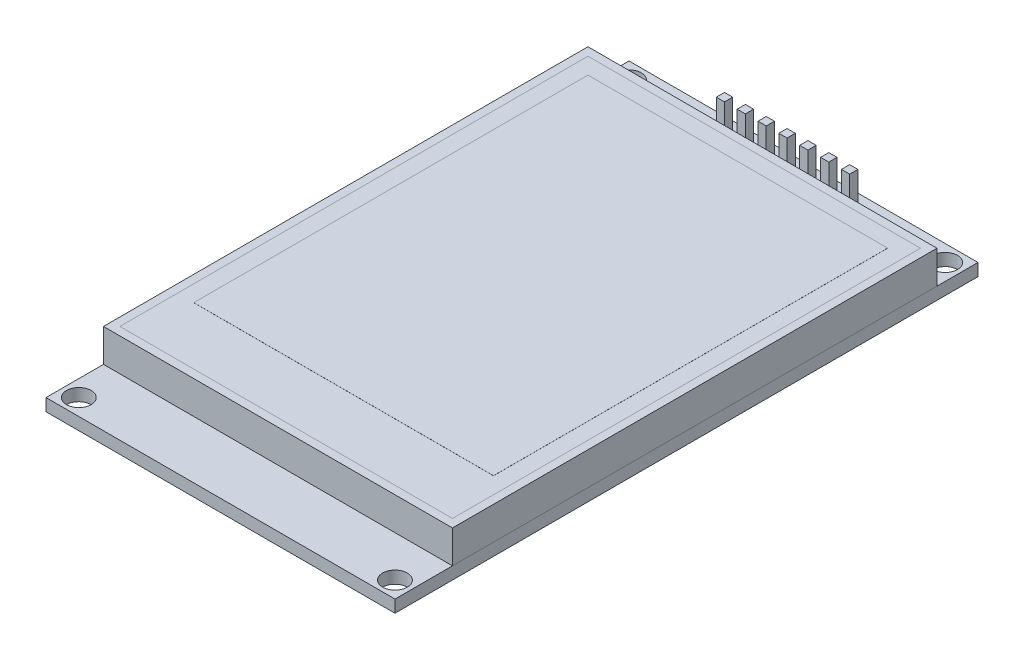
from build123d import *

# Parameters (mm, degrees)
SKETCH1_W                                  = 42.5
SKETCH1_H                                  = 71
BOSS_EXTRUDE1_DEPTH                        = 1.5
SKETCH7_R                                  = 1.5
CUT_EXTRUDE2_DEPTH                         = 42.401237904
MIRROR1_AT_THE_SECOND_PLANE_COPY_1_SKETC_R = 1.5
MIRROR1_AT_THE_SECOND_PLANE_COPY_1_DEPTH   = 42.401237904
BOSS_EXTRUDE5_START                        = -8
SKETCH8_W                                  = 1
SKETCH8_H                                  = 1
BOSS_EXTRUDE5_DEPTH                        = 12
LPATTERN1_COUNT                            = 4
LPATTERN1_PITCH                            = 2.54
LPATTERN1_COL_COUNT                        = 4
LPATTERN1_COL_PITCH                        = 2.54
SKETCH2_W                                  = 42.5
SKETCH2_H                                  = 59
BOSS_EXTRUDE2_DEPTH                        = 4
SKETCH3_W                                  = 40.5
SKETCH3_H                                  = 57
CUT_EXTRUDE1_DEPTH                         = 44.079142285
SKETCH5_W                                  = 40.5
SKETCH5_H                                  = 57
BOSS_EXTRUDE3_DEPTH                        = 4
SKETCH6_W                                  = 36.5
SKETCH6_H                                  = 48
BOSS_EXTRUDE4_DEPTH                        = 0.01


with BuildPart() as part:
    # Sketch1 → Boss-Extrude1 (new body)
    with BuildSketch(Plane(origin=(0, 0, 0), x_dir=(1, 0, 0), z_dir=(0, 1, 0))):
        Rectangle(SKETCH1_W, SKETCH1_H)
    extrude(amount=BOSS_EXTRUDE1_DEPTH)

    # Sketch7 → Cut-Extrude2 (cut, through all)
    with BuildSketch(Plane(origin=(0, 1.5, 0), x_dir=(1, 0, 0), z_dir=(0, 1, 0))):
        with Locations(Location((-19.25, 33.5, 0), (0, 0, 270))):
            Circle(SKETCH7_R)
    cut_extrude2 = extrude(amount=-CUT_EXTRUDE2_DEPTH, mode=Mode.SUBTRACT)

    # Mirror1: Cut-Extrude2 across plane
    add(cut_extrude2.mirror(Plane.XY), mode=Mode.SUBTRACT)

    # Mirror1 at the second plane: Cut-Extrude2 across plane
    add(cut_extrude2.mirror(Plane(origin=(0, 0, 0), x_dir=(0, 0, 1), z_dir=(1, 0, 0))), mode=Mode.SUBTRACT)

    # Mirror1 at the second plane copy 1 sketc → Mirror1 at the second plane copy 1 (cut, through all)
    with BuildSketch(Plane(origin=(0, 1.5, 0), x_dir=(-1, 0, 0), z_dir=(0, 1, 0))):
        with Locations(Location((-19.25, 33.5, 0), (0, 0, 270))):
            Circle(MIRROR1_AT_THE_SECOND_PLANE_COPY_1_SKETC_R)
    extrude(amount=-MIRROR1_AT_THE_SECOND_PLANE_COPY_1_DEPTH, mode=Mode.SUBTRACT)

    # Sketch8 → Boss-Extrude5 (add)
    with BuildSketch(Plane(origin=(0, 1.5, 0), x_dir=(1, 0, 0), z_dir=(0, 1, 0)).offset(BOSS_EXTRUDE5_START)):
        with Locations((0, 33.5)):
            Rectangle(SKETCH8_W, SKETCH8_H)
    boss_extrude5 = extrude(amount=BOSS_EXTRUDE5_DEPTH)

    # LPattern1: Boss-Extrude5 ×4
    with Locations(*[(i * LPATTERN1_PITCH, 0, 0) for i in range(1, LPATTERN1_COUNT)]):
        add(boss_extrude5)

    # LPattern1 col: Boss-Extrude5 ×4
    with Locations(*[(-i * LPATTERN1_COL_PITCH, 0, 0) for i in range(1, LPATTERN1_COL_COUNT)]):
        add(boss_extrude5)


with BuildPart() as body_2:
    # Sketch2 → Boss-Extrude2 (new body)
    with BuildSketch(Plane(origin=(0, 1.5, 0), x_dir=(1, 0, 0), z_dir=(0, 1, 0))):
        with Locations((0, 1)):
            Rectangle(SKETCH2_W, SKETCH2_H)
    extrude(amount=BOSS_EXTRUDE2_DEPTH)

    # Sketch3 → Cut-Extrude1 (cut, through all)
    with BuildSketch(Plane(origin=(0, 5.5, 0), x_dir=(1, 0, 0), z_dir=(0, 1, 0))):
        with Locations((0, 1)):
            Rectangle(SKETCH3_W, SKETCH3_H)
    extrude(amount=-CUT_EXTRUDE1_DEPTH, mode=Mode.SUBTRACT)


with BuildPart() as body_3:
    # Sketch5 → Boss-Extrude3 (new body)
    with BuildSketch(Plane(origin=(0, 1.5, 0), x_dir=(1, 0, 0), z_dir=(0, 1, 0))):
        with Locations((0, 1)):
            Rectangle(SKETCH5_W, SKETCH5_H)
    extrude(amount=BOSS_EXTRUDE3_DEPTH)

    # Sketch6 → Boss-Extrude4 (add)
    with BuildSketch(Plane(origin=(0, 5.5, 0), x_dir=(1, 0, 0), z_dir=(0, 1, 0))):
        with Locations((0, 3.5)):
            Rectangle(SKETCH6_W, SKETCH6_H)
    extrude(amount=BOSS_EXTRUDE4_DEPTH)


solid = Compound([part.part, body_2.part, body_3.part])
